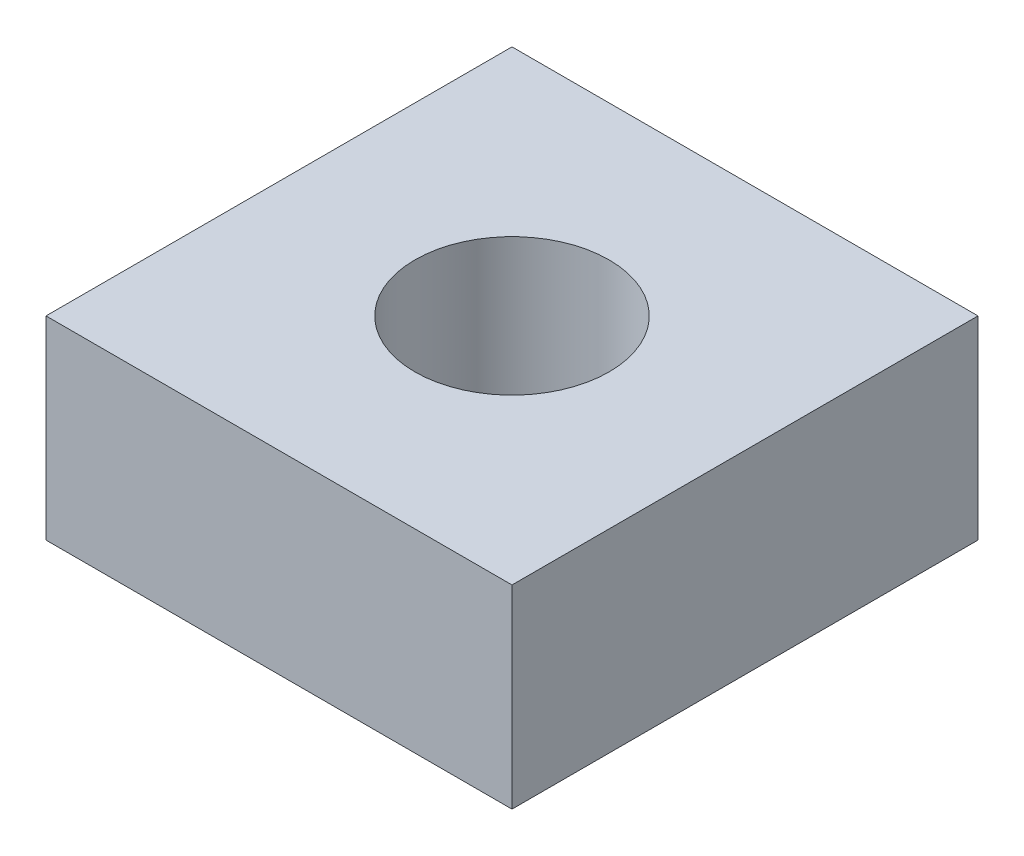
from build123d import *

# Parameters (mm, degrees)
SKETCH1_W           = 120
SKETCH1_H           = 120
SKETCH1_R           = 25
BOSS_EXTRUDE1_DEPTH = 50


with BuildPart() as part:
    # Sketch1 → Boss-Extrude1 (new body)
    with BuildSketch(Plane(origin=(0, 0, 0), x_dir=(1, 0, 0), z_dir=(0, 1, 0))):
        Rectangle(SKETCH1_W, SKETCH1_H)
        Circle(SKETCH1_R, mode=Mode.SUBTRACT)
    extrude(amount=-BOSS_EXTRUDE1_DEPTH)


solid = part.part
